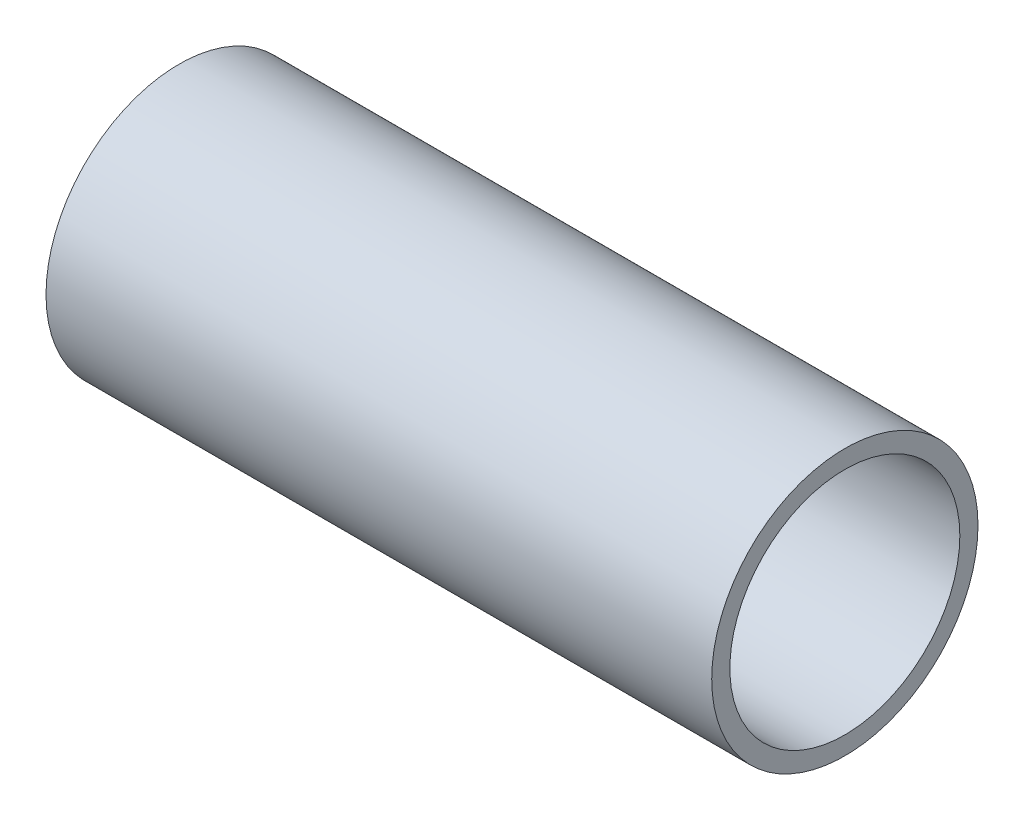
from build123d import *

# Parameters (mm, degrees)
SKETCH1_R           = 11
SKETCH1_R_2         = 9.5
BOSS_EXTRUDE1_DEPTH = 55


with BuildPart() as part:
    # Sketch1 → Boss-Extrude1 (new body)
    with BuildSketch(Plane(origin=(0, 0, 0), x_dir=(0, 0, -1), z_dir=(1, 0, 0))):
        Circle(SKETCH1_R)
        Circle(SKETCH1_R_2, mode=Mode.SUBTRACT)
    extrude(amount=BOSS_EXTRUDE1_DEPTH)


solid = part.part
